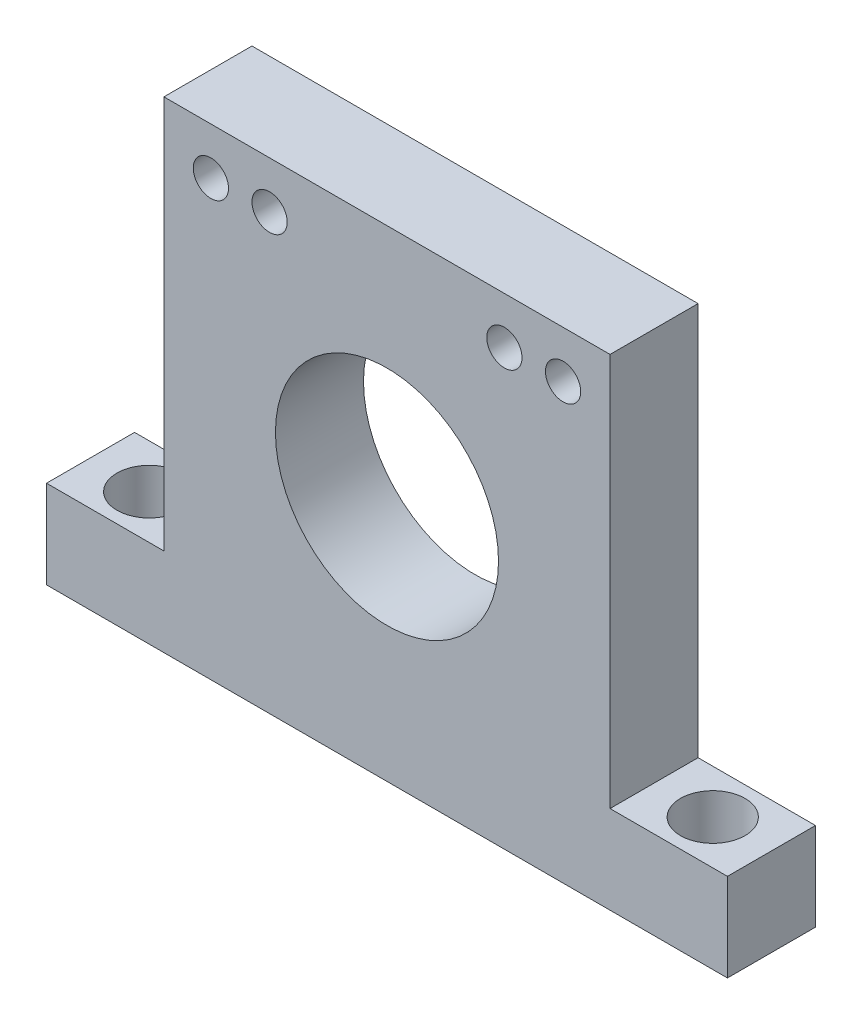
from build123d import *

# Parameters (mm, degrees)
SKETCH1_R           = 9.5
BOSS_EXTRUDE1_DEPTH = 7.5
SKETCH2_R           = 1.5
CUT_EXTRUDE2_DEPTH  = 51.776470929
SKETCH3_R           = 2.75
CUT_EXTRUDE3_DEPTH  = 45.938847337


with BuildPart() as part:
    # Sketch1 → Boss-Extrude1 (new body)
    with BuildSketch(Plane.XY):
        Polygon((-29, 0), (29, 0), (29, 7.5), (19, 7.5), (19, 41), (-19, 41), (-19, 7.5), (-29, 7.5), align=None)
        with Locations((0, 21)):
            Circle(SKETCH1_R, mode=Mode.SUBTRACT)
    extrude(amount=-BOSS_EXTRUDE1_DEPTH)

    # Sketch2 → Cut-Extrude2 (cut, through all)
    with BuildSketch(Plane.XY):
        with Locations((10, 37)):
            Circle(SKETCH2_R)
        with Locations((15, 37)):
            Circle(SKETCH2_R)
        with Locations(Location((-15, 37, 0), (0, 0, 180))):
            Circle(SKETCH2_R)
        with Locations(Location((-10, 37, 0), (0, 0, 180))):
            Circle(SKETCH2_R)
    extrude(amount=-CUT_EXTRUDE2_DEPTH, mode=Mode.SUBTRACT)

    # Sketch3 → Cut-Extrude3 (cut, through all)
    with BuildSketch(Plane(origin=(0, 7.5, 0), x_dir=(1, 0, 0), z_dir=(0, 1, 0))):
        with Locations(Location((-24, 3.75, 0), (0, 0, 180))):
            Circle(SKETCH3_R)
        with Locations(Location((24, 3.75, 0), (0, 0, 180))):
            Circle(SKETCH3_R)
    extrude(amount=-CUT_EXTRUDE3_DEPTH, mode=Mode.SUBTRACT)


solid = part.part
